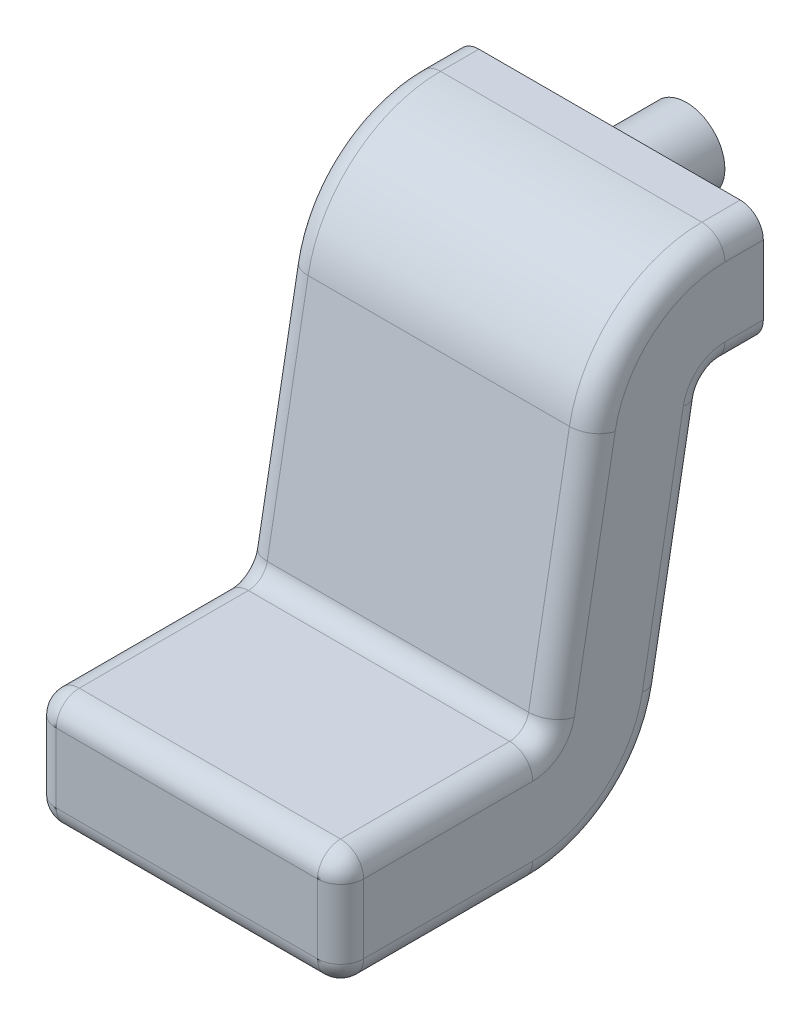
from build123d import *

# Parameters (mm, degrees)
FILETE2_R                = 0.03
ESBO_O3_R                = 0.05
RESSALTO_EXTRUS_O1_DEPTH = 0.1


with BuildPart() as part:
    # Varredura1: sweep along a path in Esboço2
    with BuildLine(Plane(origin=(0, 0, 0), x_dir=(0, 0, -1), z_dir=(1, 0, 0))) as varredura1_path:
        Line((0, 0), (0.25, 0))
        ThreePointArc((0.25, 0), (0.314144085, 0.023282751), (0.348419155, 0.082289274))
        Line((0.348419155, 0.082289274), (0.401580845, 0.377710726))
        ThreePointArc((0.401580845, 0.377710726), (0.435855915, 0.436717249), (0.5, 0.46))
        Line((0.5, 0.46), (0.55, 0.46))
    # Esboço1 → Varredura1 (sweep)
    with BuildSketch(Plane.XY):
        with BuildLine():
            Line((-0.17, -0.075), (0.17, -0.075))
            ThreePointArc((0.17, -0.075), (0.191213203, -0.066213203), (0.2, -0.045))
            Line((0.2, -0.045), (0.2, 0.045))
            ThreePointArc((0.2, 0.045), (0.191213203, 0.066213203), (0.17, 0.075))
            Line((0.17, 0.075), (-0.17, 0.075))
            ThreePointArc((-0.17, 0.075), (-0.191213203, 0.066213203), (-0.2, 0.045))
            Line((-0.2, 0.045), (-0.2, -0.045))
            ThreePointArc((-0.2, -0.045), (-0.191213203, -0.066213203), (-0.17, -0.075))
        make_face()
    sweep(path=varredura1_path.line)

    # Filete2
    filete2_edges = [part.edges().sort_by_distance(p)[0] for p in [
        (-0.2, 0, 0),
        (-0.191213203, 0.066213203, 0),
        (0, 0.075, 0),
        (0.191213203, 0.066213203, 0),
        (0.2, 0, 0),
        (0.191213203, -0.066213203, 0),
        (0, -0.075, 0),
        (-0.191213203, -0.066213203, 0),
    ]]
    fillet(filete2_edges, radius=FILETE2_R)

    # Esboço3 → Ressalto-extrusão1 (add)
    with BuildSketch(Plane(origin=(0, 0, -0.55), x_dir=(-1, 0, 0), z_dir=(0, 0, -1))):
        with Locations(Location((0, 0.46, 0), (0, 0, 270))):
            Circle(ESBO_O3_R)
    extrude(amount=RESSALTO_EXTRUS_O1_DEPTH)


solid = part.part
